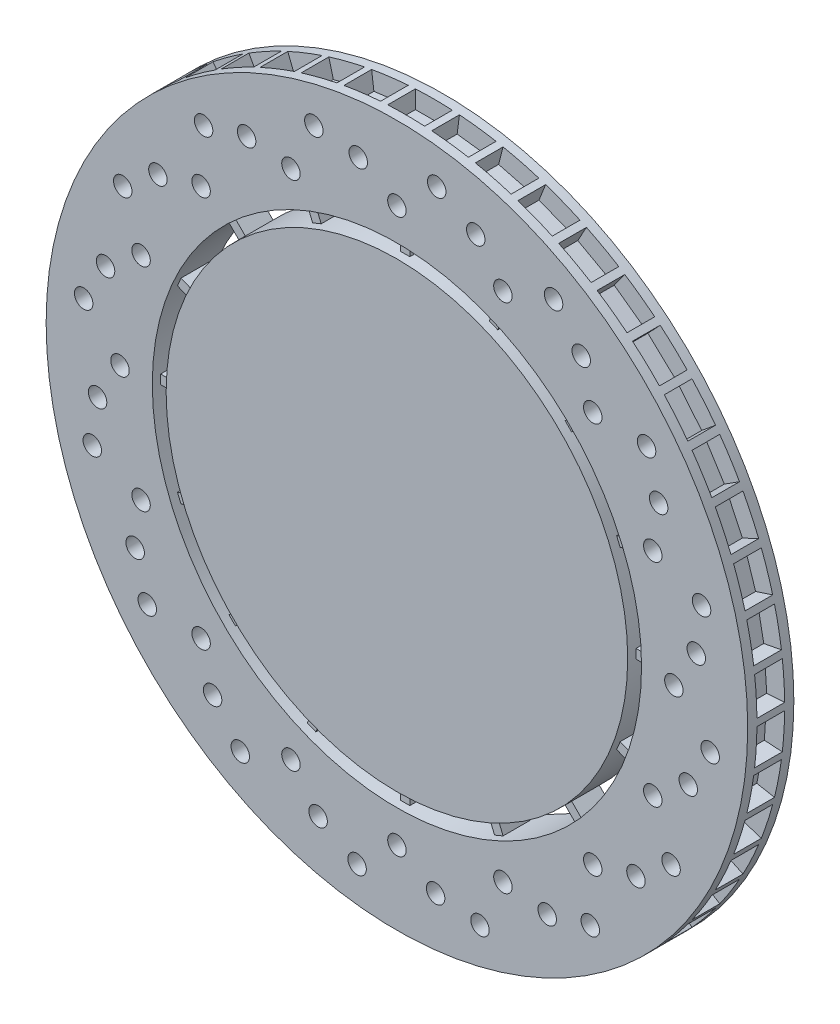
from build123d import *

# Parameters (mm, degrees)
SKETCH1_R                = 125
BOSS_EXTRUDE1_DEPTH      = 35
CHAMFER1_SIZE            = 40
CHAMFER1_SIZE2           = 10.717967697
SKETCH2_R                = 190
SKETCH2_R_2              = 132.5
BOSS_EXTRUDE2_DEPTH      = 25
BOSS_EXTRUDE3_REACH      = 272.97
BOSS_EXTRUDE3_END_RADIUS = 132.5
SKETCH4_W                = 5
SKETCH4_H                = 15
CIRPATTERN1_COUNT        = 16
SKETCH6_R                = 5
CUT_EXTRUDE2_DEPTH       = 270.86107537
CIRPATTERN3_COUNT        = 16
CUT_EXTRUDE3_START       = 180
SKETCH7_W                = 20
SKETCH7_H                = 15
CUT_EXTRUDE3_DEPTH       = 91.970478097
CIRPATTERN4_COUNT        = 50


with BuildPart() as part:
    # Sketch1 → Boss-Extrude1 (new body)
    with BuildSketch(Plane.XY):
        Circle(SKETCH1_R)
    extrude(amount=BOSS_EXTRUDE1_DEPTH)

    # Chamfer1
    chamfer1_edges = [part.edges().sort_by_distance(p)[0] for p in [
        (-125, 0, 0),
    ]]
    chamfer1_side = [part.faces().sort_by_distance(p)[0] for p in [
        (0, 0, 0),
    ]]
    chamfer(chamfer1_edges, length=CHAMFER1_SIZE, length2=CHAMFER1_SIZE2, reference=chamfer1_side[0])



with BuildPart() as body_2:
    # Sketch2 → Boss-Extrude2 (new body)
    with BuildSketch(Plane.XY.offset(35)):
        Circle(SKETCH2_R)
        Circle(SKETCH2_R_2, mode=Mode.SUBTRACT)
    extrude(amount=-BOSS_EXTRUDE2_DEPTH)


with BuildPart() as part_1:
    add(part.part)

    add(body_2.part)  # Boss-Extrude3 merges body 2
    # Boss-Extrude3: up to this cylinder (the profile starts inside it)
    boss_extrude3_end = Plane(origin=(0, 0, 23), z_dir=(0, 0, 1)) * Cylinder(BOSS_EXTRUDE3_END_RADIUS, 811.94, mode=Mode.PRIVATE)
    # Sketch4 → Boss-Extrude3 (add, up to the surface)
    with BuildSketch(Plane(origin=(0, 0, 0), x_dir=(1, 0, 0), z_dir=(0, 1, 0)), mode=Mode.PRIVATE) as boss_extrude3_sk1:
        with Locations((0, -23)):
            Rectangle(SKETCH4_W, SKETCH4_H)
    boss_extrude3_tool1 = extrude(boss_extrude3_sk1.sketch, amount=BOSS_EXTRUDE3_REACH, mode=Mode.PRIVATE) & boss_extrude3_end
    boss_extrude3 = boss_extrude3_tool1.solids().sort_by_distance((0, 0, 23))[0]
    add(boss_extrude3)

    # CirPattern1: Boss-Extrude3 ×16 about axis
    cirpattern1_axis = Axis((0, 0, 10), (0, 0, 1))
    for i in range(1, CIRPATTERN1_COUNT):
        add(boss_extrude3.rotate(cirpattern1_axis, i * 360 / CIRPATTERN1_COUNT))

    # Sketch6 → Cut-Extrude2 (cut, through all)
    with BuildSketch(Plane(origin=(0, 0, 10), x_dir=(-1, 0, 0), z_dir=(0, 0, -1))):
        with Locations((0, 150)):
            Circle(SKETCH6_R)
        with Locations((20.954759097, 162.135722709)):
            Circle(SKETCH6_R)
        with Locations((45, 165)):
            Circle(SKETCH6_R)
    cut_extrude2 = extrude(amount=-CUT_EXTRUDE2_DEPTH, mode=Mode.SUBTRACT)

    # CirPattern3: Cut-Extrude2 ×16 about axis
    cirpattern3_axis = Axis((0, 0, 10), (0, 0, 1))
    for i in range(1, CIRPATTERN3_COUNT):
        add(cut_extrude2.rotate(cirpattern3_axis, i * 360 / CIRPATTERN3_COUNT), mode=Mode.SUBTRACT)

    # Sketch7 → Cut-Extrude3 (cut, through all)
    with BuildSketch(Plane(origin=(0, 0, 0), x_dir=(1, 0, 0), z_dir=(0, 1, 0)).offset(CUT_EXTRUDE3_START)):
        with Locations((0, -22.5)):
            Rectangle(SKETCH7_W, SKETCH7_H)
    cut_extrude3 = extrude(amount=CUT_EXTRUDE3_DEPTH, mode=Mode.SUBTRACT)

    # CirPattern4: Cut-Extrude3 ×50 about axis
    cirpattern4_axis = Axis((0, 0, 10), (0, 0, 1))
    for i in range(1, CIRPATTERN4_COUNT):
        add(cut_extrude3.rotate(cirpattern4_axis, i * 360 / CIRPATTERN4_COUNT), mode=Mode.SUBTRACT)


solid = part_1.part
